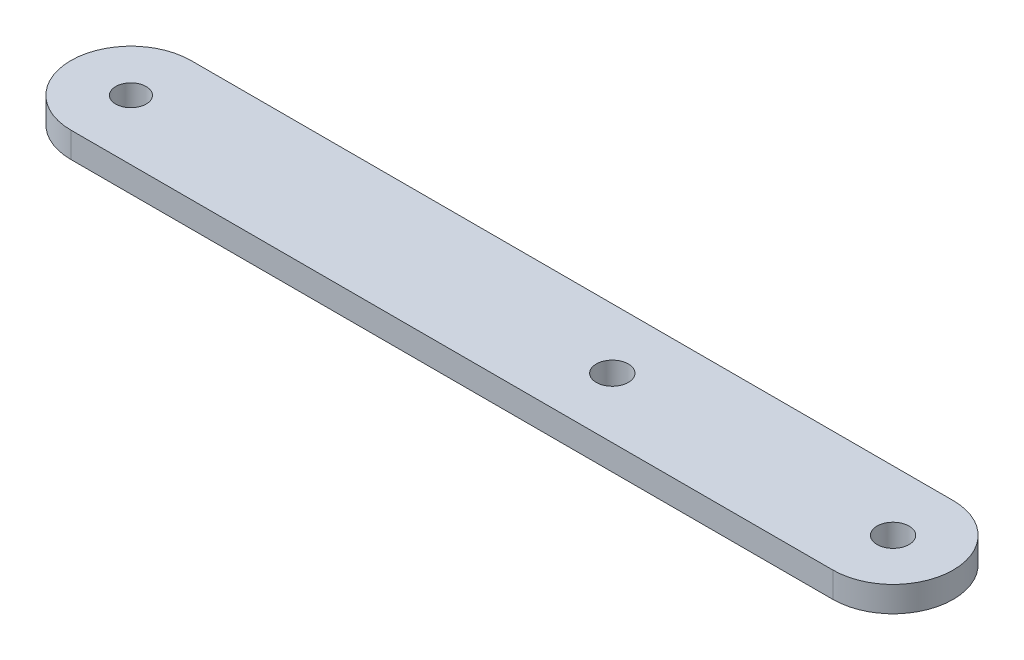
from build123d import *

# Parameters (mm, degrees)
SKETCH1_R           = 1.9
SKETCH1_R_2         = 2
BOSS_EXTRUDE1_DEPTH = 3.175


with BuildPart() as part:
    # Sketch1 → Boss-Extrude1 (new body)
    with BuildSketch(Plane(origin=(0, 0, 0), x_dir=(1, 0, 0), z_dir=(0, 1, 0))):
        with BuildLine():
            Line((0, 7.5), (95, 7.5))
            ThreePointArc((95, 7.5), (102.5, 0), (95, -7.5))
            Line((95, -7.5), (0, -7.5))
            ThreePointArc((0, -7.5), (-7.5, 0), (0, 7.5))
        make_face()
        with Locations(Location((0, 0, 0), (0, 0, 270))):
            Circle(SKETCH1_R, mode=Mode.SUBTRACT)
        with Locations(Location((60, 0, 0), (0, 0, 270))):
            Circle(SKETCH1_R_2, mode=Mode.SUBTRACT)
        with Locations(Location((95, 0, 0), (0, 0, 270))):
            Circle(SKETCH1_R_2, mode=Mode.SUBTRACT)
    extrude(amount=BOSS_EXTRUDE1_DEPTH)


solid = part.part
